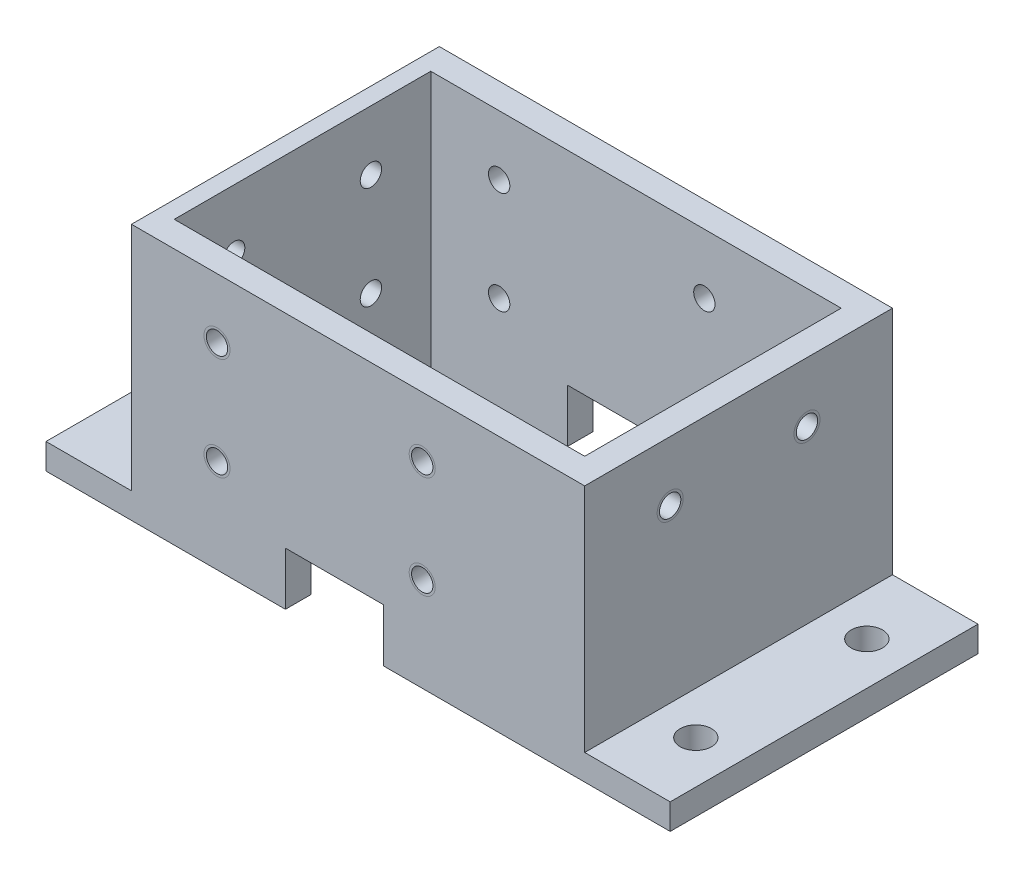
from build123d import *

# Parameters (mm, degrees)
SKETCH1_W                   = 36
SKETCH1_H                   = 38
BOSS_EXTRUDE2_DEPTH         = 53
SKETCH3_W                   = 30
SKETCH3_H                   = 35
CUT_EXTRUDE1_DEPTH          = 51
SKETCH4_W                   = 3
SKETCH4_H                   = 30
BOSS_EXTRUDE3_DEPTH         = 33
SKETCH5_W                   = 53
SKETCH5_H                   = 8
CUT_EXTRUDE2_DEPTH          = 52
SKETCH6_W                   = 53
SKETCH6_H                   = 7
BOSS_EXTRUDE4_DEPTH         = 3
CUT_EXTRUDE4_DEPTH          = 79.797208072
CUT_EXTRUDE4_DEPTH_BACK     = 79.797208072
SKETCH8_W                   = 11.5
SKETCH8_H                   = 3
M3_TAPPED_HOLE1_D           = 2.5
M3_TAPPED_HOLE1_DEPTH       = 3
M3_TAPPED_HOLE1_CSINK_D     = 3.05
M3_TAPPED_HOLE1_CSINK_ANGLE = 179
LPATTERN1_COUNT             = 2
LPATTERN1_PITCH             = 24
LPATTERN1_COUNT_DIR2        = 2
LPATTERN1_PITCH_DIR2        = 12
M3_TAPPED_HOLE2_D           = 2.5
M3_TAPPED_HOLE2_DEPTH       = 2
M3_TAPPED_HOLE2_CSINK_D     = 3.05
M3_TAPPED_HOLE2_CSINK_ANGLE = 179
LPATTERN2_COUNT             = 2
LPATTERN2_PITCH             = 16
LPATTERN2_COUNT_DIR2        = 2
LPATTERN2_PITCH_DIR2        = 12
M3_TAPPED_HOLE3_D           = 2.5
M3_TAPPED_HOLE3_CSINK_D     = 3.05
M3_TAPPED_HOLE3_CSINK_ANGLE = 179
LPATTERN3_COUNT             = 2
LPATTERN3_PITCH             = 16
M3_TAPPED_HOLE4_D           = 2.5
M3_TAPPED_HOLE4_CSINK_D     = 3.05
M3_TAPPED_HOLE4_CSINK_ANGLE = 179
LPATTERN4_COUNT             = 2
LPATTERN4_PITCH             = 24
LPATTERN4_COUNT_DIR2        = 2
LPATTERN4_PITCH_DIR2        = 12
SKETCH45_R                  = 1.833333333
CUT_EXTRUDE5_DEPTH          = 74.396185187
LPATTERN5_COUNT             = 2
LPATTERN5_PITCH             = 35
LPATTERN5_COUNT_DIR2        = 2
LPATTERN5_PITCH_DIR2        = 43
CUT_EXTRUDE6_DEPTH          = 75.551995278
CUT_EXTRUDE6_DEPTH_BACK     = 75.551995278
SKETCH46_W                  = 11.5
SKETCH46_H                  = 3.2
CUT_EXTRUDE7_DEPTH          = 74.396185187
CUT_EXTRUDE7_DEPTH_BACK     = 74.396185187
SKETCH47_W                  = 53
SKETCH47_H                  = 7
BOSS_EXTRUDE5_START         = -30
SKETCH49_W                  = 10
SKETCH49_H                  = 36
BOSS_EXTRUDE5_DEPTH         = 3
CUT_EXTRUDE8_DEPTH          = 78.420927403
CUT_EXTRUDE8_DEPTH_BACK     = 78.420927403
SKETCH50_R                  = 1.835


with BuildPart() as part:
    # Sketch1 → Boss-Extrude2 (new body)
    with BuildSketch(Plane(origin=(0, 0, 0), x_dir=(0, 0, -1), z_dir=(1, 0, 0))):
        with Locations((18, 19)):
            Rectangle(SKETCH1_W, SKETCH1_H)
    extrude(amount=BOSS_EXTRUDE2_DEPTH)

    # Sketch3 → Cut-Extrude1 (cut)
    with BuildSketch(Plane(origin=(53, 0, 0), x_dir=(0, 0, -1), z_dir=(1, 0, 0))):
        with Locations((18, 17.5)):
            Rectangle(SKETCH3_W, SKETCH3_H)
    extrude(amount=-CUT_EXTRUDE1_DEPTH, mode=Mode.SUBTRACT)

    # Sketch4 → Boss-Extrude3 (add)
    with BuildSketch(Plane.XY):
        with Locations((51.5, 15)):
            Rectangle(SKETCH4_W, SKETCH4_H)
    extrude(amount=-BOSS_EXTRUDE3_DEPTH)

    # Sketch5 → Cut-Extrude2 (cut)
    with BuildSketch(Plane.XY):
        with Locations((26.5, 34)):
            Rectangle(SKETCH5_W, SKETCH5_H)
    extrude(amount=-CUT_EXTRUDE2_DEPTH, mode=Mode.SUBTRACT)

    # Sketch6 → Boss-Extrude4 (add)
    with BuildSketch(Plane(origin=(0, 0, 0), x_dir=(-1, 0, 0), z_dir=(0, -1, 0))):
        with Locations((-26.5, -3.5)):
            Rectangle(SKETCH6_W, SKETCH6_H)
        with Locations((-26.5, 39.5)):
            Rectangle(SKETCH6_W, SKETCH6_H)
    extrude(amount=-BOSS_EXTRUDE4_DEPTH)

    # Sketch8 → Cut-Extrude4 (cut, two sides: drawn at the far end of the back side and taken through both)
    with BuildSketch(Plane(origin=(0, 0, -43), x_dir=(-1, 0, 0), z_dir=(0, 0, -1)).offset(-CUT_EXTRUDE4_DEPTH_BACK)):
        with Locations((-23.75, 1.5)):
            Rectangle(SKETCH8_W, SKETCH8_H)
    extrude(amount=CUT_EXTRUDE4_DEPTH + CUT_EXTRUDE4_DEPTH_BACK, mode=Mode.SUBTRACT)

    # M3 Tapped Hole1
    with Locations(Plane.XY):
        with Locations((10, 23)):
            m3_tapped_hole1 = CounterSinkHole(M3_TAPPED_HOLE1_D / 2, M3_TAPPED_HOLE1_CSINK_D / 2, depth=M3_TAPPED_HOLE1_DEPTH, counter_sink_angle=M3_TAPPED_HOLE1_CSINK_ANGLE)

    # LPattern1: M3 Tapped Hole1 2 × 2
    with Locations(*[(i * LPATTERN1_PITCH, -j * LPATTERN1_PITCH_DIR2, 0) for i in range(LPATTERN1_COUNT) for j in range(LPATTERN1_COUNT_DIR2) if (i, j) != (0, 0)]):
        add(m3_tapped_hole1, mode=Mode.SUBTRACT)

    # M3 Tapped Hole2
    with Locations(Plane.ZY):
        with Locations((-26, 23)):
            m3_tapped_hole2 = CounterSinkHole(M3_TAPPED_HOLE2_D / 2, M3_TAPPED_HOLE2_CSINK_D / 2, depth=M3_TAPPED_HOLE2_DEPTH, counter_sink_angle=M3_TAPPED_HOLE2_CSINK_ANGLE)

    # LPattern2: M3 Tapped Hole2 2 × 2
    with Locations(*[(0, -j * LPATTERN2_PITCH_DIR2, i * LPATTERN2_PITCH) for i in range(LPATTERN2_COUNT) for j in range(LPATTERN2_COUNT_DIR2) if (i, j) != (0, 0)]):
        add(m3_tapped_hole2, mode=Mode.SUBTRACT)

    # M3 Tapped Hole3 (through all)
    with Locations(Plane(origin=(53, 0, 0), x_dir=(0, 0, -1), z_dir=(1, 0, 0))):
        with Locations((26, 23)):
            m3_tapped_hole3 = CounterSinkHole(M3_TAPPED_HOLE3_D / 2, M3_TAPPED_HOLE3_CSINK_D / 2, counter_sink_angle=M3_TAPPED_HOLE3_CSINK_ANGLE)

    # LPattern3: M3 Tapped Hole3 ×2
    with Locations(*[(0, 0, i * LPATTERN3_PITCH) for i in range(1, LPATTERN3_COUNT)]):
        add(m3_tapped_hole3, mode=Mode.SUBTRACT)

    # M3 Tapped Hole4 (through all)
    with Locations(Plane(origin=(0, 0, -36), x_dir=(-1, 0, 0), z_dir=(0, 0, -1))):
        with Locations((-10, 23)):
            m3_tapped_hole4 = CounterSinkHole(M3_TAPPED_HOLE4_D / 2, M3_TAPPED_HOLE4_CSINK_D / 2, counter_sink_angle=M3_TAPPED_HOLE4_CSINK_ANGLE)

    # LPattern4: M3 Tapped Hole4 2 × 2
    with Locations(*[(i * LPATTERN4_PITCH, -j * LPATTERN4_PITCH_DIR2, 0) for i in range(LPATTERN4_COUNT) for j in range(LPATTERN4_COUNT_DIR2) if (i, j) != (0, 0)]):
        add(m3_tapped_hole4, mode=Mode.SUBTRACT)

    # Sketch45 → Cut-Extrude5 (cut, symmetric)
    with BuildSketch(Plane(origin=(0, 3, 0), x_dir=(1, 0, 0), z_dir=(0, 1, 0))):
        with Locations(Location((8, 39.5, 0), (0, 0, 270))):
            Circle(SKETCH45_R)
    cut_extrude5 = extrude(amount=CUT_EXTRUDE5_DEPTH, both=True, mode=Mode.SUBTRACT)

    # LPattern5: Cut-Extrude5 2 × 2
    with Locations(*[(i * LPATTERN5_PITCH, 0, j * LPATTERN5_PITCH_DIR2) for i in range(LPATTERN5_COUNT) for j in range(LPATTERN5_COUNT_DIR2) if (i, j) != (0, 0)]):
        add(cut_extrude5, mode=Mode.SUBTRACT)

    # Sketch46 → Cut-Extrude6 (cut, two sides: drawn at the far end of the back side and taken through both)
    with BuildSketch(Plane(origin=(0, 0, -36), x_dir=(-1, 0, 0), z_dir=(0, 0, -1)).offset(-CUT_EXTRUDE6_DEPTH_BACK)):
        with Locations((-23.75, 4.6)):
            Rectangle(SKETCH46_W, SKETCH46_H)
    extrude(amount=CUT_EXTRUDE6_DEPTH + CUT_EXTRUDE6_DEPTH_BACK, mode=Mode.SUBTRACT)

    # Sketch47 → Cut-Extrude7 (cut, two sides: drawn at the far end of the back side and taken through both)
    with BuildSketch(Plane(origin=(0, 3, 0), x_dir=(1, 0, 0), z_dir=(0, 1, 0)).offset(-CUT_EXTRUDE7_DEPTH_BACK)):
        with Locations((26.5, 39.5)):
            Rectangle(SKETCH47_W, SKETCH47_H)
        with Locations((26.5, -3.5)):
            Rectangle(SKETCH47_W, SKETCH47_H)
    extrude(amount=CUT_EXTRUDE7_DEPTH + CUT_EXTRUDE7_DEPTH_BACK, mode=Mode.SUBTRACT)

    # Sketch49 → Boss-Extrude5 (add)
    with BuildSketch(Plane(origin=(0, 30, 0), x_dir=(1, 0, 0), z_dir=(0, 1, 0)).offset(BOSS_EXTRUDE5_START)):
        with Locations((-5, 18)):
            Rectangle(SKETCH49_W, SKETCH49_H)
        with Locations((58, 18)):
            Rectangle(SKETCH49_W, SKETCH49_H)
    extrude(amount=BOSS_EXTRUDE5_DEPTH)

    # Sketch50 → Cut-Extrude8 (cut, two sides: drawn at the far end of the back side and taken through both)
    with BuildSketch(Plane(origin=(0, 3, 0), x_dir=(1, 0, 0), z_dir=(0, 1, 0)).offset(-CUT_EXTRUDE8_DEPTH_BACK)):
        with Locations(Location((-5, 28, 0), (0, 0, 270))):
            Circle(SKETCH50_R)
        with Locations(Location((-5, 8, 0), (0, 0, 270))):
            Circle(SKETCH50_R)
        with Locations(Location((58, 8, 0), (0, 0, 270))):
            Circle(SKETCH50_R)
        with Locations(Location((58, 28, 0), (0, 0, 270))):
            Circle(SKETCH50_R)
    extrude(amount=CUT_EXTRUDE8_DEPTH + CUT_EXTRUDE8_DEPTH_BACK, mode=Mode.SUBTRACT)


solid = part.part
